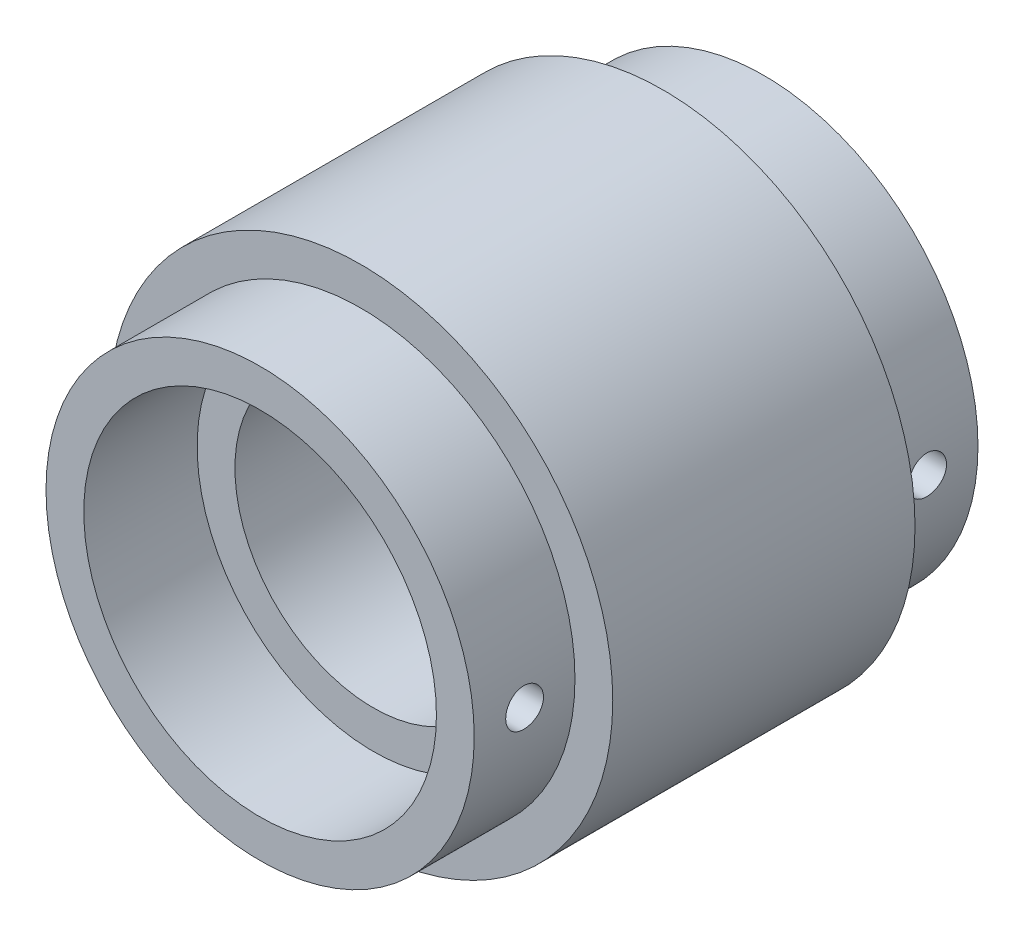
from build123d import *

# Parameters (mm, degrees)
SKETCH1_R               = 20
BOSS_EXTRUDE1_DEPTH     = 20
SKETCH4_R               = 20
SKETCH4_R_2             = 17
CUT_EXTRUDE1_DEPTH      = 8
CUT_EXTRUDE2_REACH      = 36.641
CUT_EXTRUDE2_END_RADIUS = 17
SKETCH5_R               = 1.5


with BuildPart() as part:
    # Sketch1 → Boss-Extrude1 (new, symmetric)
    with BuildSketch(Plane.XY):
        Circle(SKETCH1_R)
    extrude(amount=BOSS_EXTRUDE1_DEPTH, both=True)

    # Sketch3 → Hole1 (revolve, cut)
    with BuildSketch(Plane(origin=(0, 0, 20), x_dir=(0, -1, 0), z_dir=(1, 0, 0))):
        Polygon((0, 0), (0, 46.609466809), (11, 40), (11, 9), (14, 9), (14, 0), align=None)
    hole1 = revolve(axis=Axis((0, 0, 31.310875039), (0, 0, -1)), mode=Mode.SUBTRACT)

    # Sketch4 → Cut-Extrude1 (cut)
    with BuildSketch(Plane.XY.offset(20)):
        Circle(SKETCH4_R)
        Circle(SKETCH4_R_2, mode=Mode.SUBTRACT)
    cut_extrude1 = extrude(amount=-CUT_EXTRUDE1_DEPTH, mode=Mode.SUBTRACT)

    # Mirror2: Hole1, Cut-Extrude1 across plane
    add(hole1.mirror(Plane.XY), mode=Mode.SUBTRACT)
    add(cut_extrude1.mirror(Plane.XY), mode=Mode.SUBTRACT)

    # Cut-Extrude2: up to this cylinder (the profile starts inside it)
    cut_extrude2_end = Plane(origin=(0, 0, 0), z_dir=(0, 0, 1)) * Cylinder(CUT_EXTRUDE2_END_RADIUS, 140.282, mode=Mode.PRIVATE)
    # Sketch5 → Cut-Extrude2 (cut, up to the surface)
    with BuildSketch(Plane(origin=(0, 0, 0), x_dir=(0, 0, -1), z_dir=(1, 0, 0)), mode=Mode.PRIVATE) as cut_extrude2_sk1:
        with Locations(Location((-16, 0, 0), (0, 0, 180))):
            Circle(SKETCH5_R)
    cut_extrude2_tool1 = extrude(cut_extrude2_sk1.sketch, amount=CUT_EXTRUDE2_REACH, mode=Mode.PRIVATE) & cut_extrude2_end
    add(cut_extrude2_tool1.solids().sort_by_distance((0, 0, 16))[0], mode=Mode.SUBTRACT)
    # Sketch5 → Cut-Extrude2 (cut, up to the surface)
    with BuildSketch(Plane(origin=(0, 0, 0), x_dir=(0, 0, -1), z_dir=(1, 0, 0)), mode=Mode.PRIVATE) as cut_extrude2_sk2:
        with Locations(Location((16, 0, 0), (0, 0, 180))):
            Circle(SKETCH5_R)
    cut_extrude2_tool2 = extrude(cut_extrude2_sk2.sketch, amount=CUT_EXTRUDE2_REACH, mode=Mode.PRIVATE) & cut_extrude2_end
    add(cut_extrude2_tool2.solids().sort_by_distance((0, 0, -16))[0], mode=Mode.SUBTRACT)


solid = part.part
